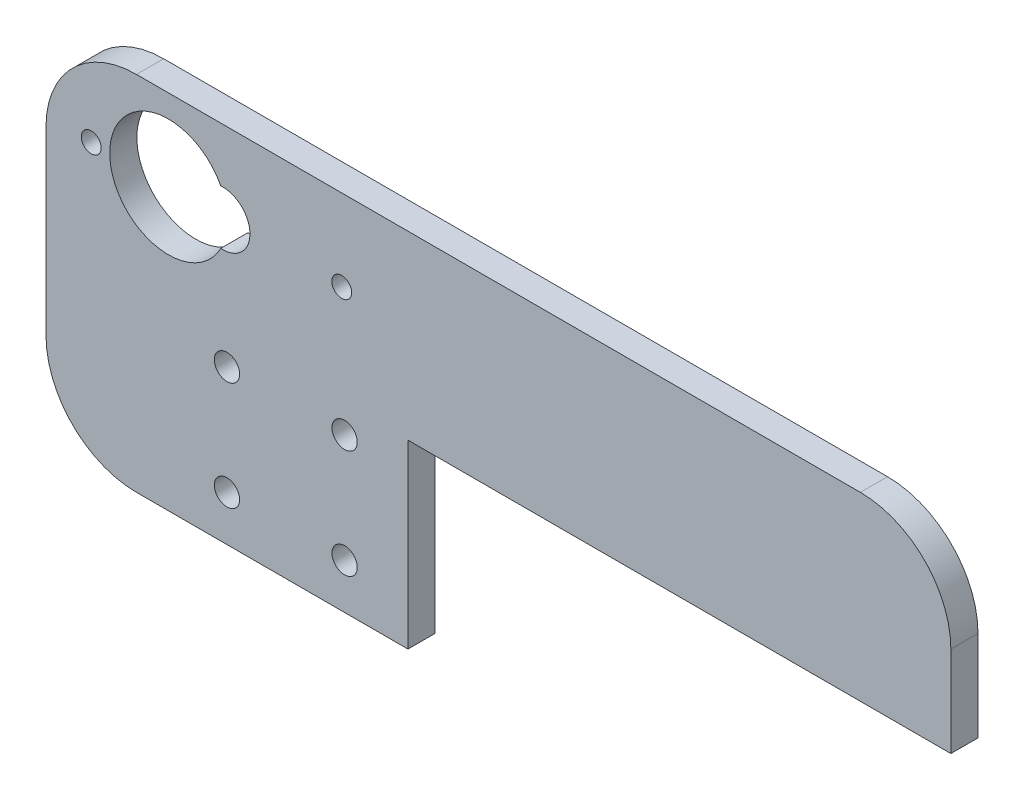
from build123d import *

# Parameters (mm, degrees)
SKETCH_1_W          = 100
SKETCH_1_H          = 40
EXTRUDE_1_DEPTH     = 3
SKETCH_6_R          = 1.4
CUT_EXTRUDE_4_DEPTH = 3
SKETCH_7_W          = 60
SKETCH_7_H          = 20
CUT_EXTRUDE_5_DEPTH = 3
SKETCH_8_R          = 3
SKETCH_8_R_2        = 6.5
SKETCH_8_R_3        = 1.1
CUT_EXTRUDE_6_DEPTH = 3
FILLET_1_R          = 10


with BuildPart() as part:
    # 草图1 → 凸台-拉伸1 (new body)
    with BuildSketch(Plane.XY):
        with Locations((50, 20)):
            Rectangle(SKETCH_1_W, SKETCH_1_H)
    extrude(amount=EXTRUDE_1_DEPTH)

    # 草图6 → 切除-拉伸4 (cut)
    with BuildSketch(Plane(origin=(0, 0, 0), x_dir=(-1, 0, 0), z_dir=(0, 0, -1))):
        with Locations((-20, 5)):
            Circle(SKETCH_6_R)
        with Locations((-20, 17)):
            Circle(SKETCH_6_R)
        with Locations((-33, 17)):
            Circle(SKETCH_6_R)
        with Locations((-33, 5)):
            Circle(SKETCH_6_R)
    extrude(amount=-CUT_EXTRUDE_4_DEPTH, mode=Mode.SUBTRACT)

    # 草图7 → 切除-拉伸5 (cut)
    with BuildSketch(Plane.XY.offset(3)):
        with Locations((70, 10)):
            Rectangle(SKETCH_7_W, SKETCH_7_H)
    extrude(amount=-CUT_EXTRUDE_5_DEPTH, mode=Mode.SUBTRACT)

    # 草图8 → 切除-拉伸6 (cut)
    with BuildSketch(Plane.XY.offset(3)):
        with Locations((19.54, 31)):
            Circle(SKETCH_8_R)
        with Locations((13.54, 31)):
            Circle(SKETCH_8_R_2)
        with Locations((5, 31)):
            Circle(SKETCH_8_R_3)
        with Locations((32.68, 31)):
            Circle(SKETCH_8_R_3)
    extrude(amount=-CUT_EXTRUDE_6_DEPTH, mode=Mode.SUBTRACT)

    # 圆角1
    fillet_1_edges = [part.edges().sort_by_distance(p)[0] for p in [
        (0, 40, 1.5),
        (100, 40, 1.5),
        (0, 0, 1.5),
    ]]
    fillet(fillet_1_edges, radius=FILLET_1_R)


solid = part.part
